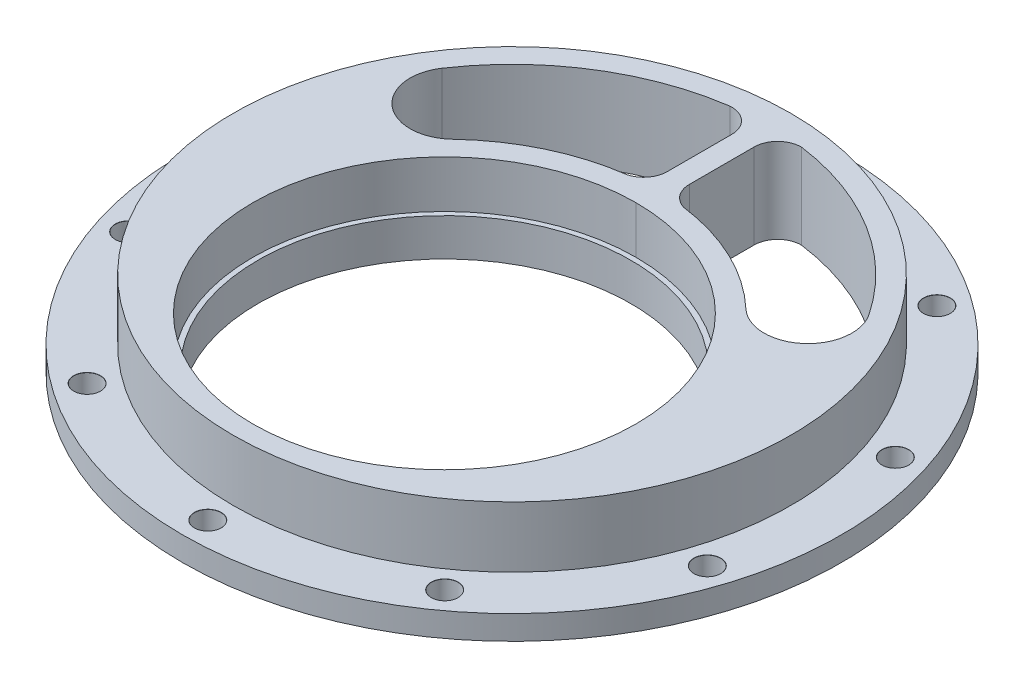
from build123d import *

# Parameters (mm, degrees)
SKETCH1_R                       = 61.9125
SKETCH1_R_2                     = 35.052
BOSS_EXTRUDE1_DEPTH             = 4.5212
SKETCH3_R                       = 52.3875
BOSS_EXTRUDE2_DEPTH             = 11.43
SKETCH4_R                       = 35.052
CUT_EXTRUDE1_DEPTH              = 89.998629731
SKETCH9_R                       = 36.000000009
CUT_EXTRUDE3_DEPTH              = 8.89
F_5_0MM_DOWEL_HOLE1_D           = 5
F_5_0MM_DOWEL_HOLE1_CSINK_D     = 5.05
F_5_0MM_DOWEL_HOLE1_CSINK_ANGLE = 90
CIRPATTERN1_COUNT               = 10
CUT_EXTRUDE5_DEPTH              = 89.998629731
BOSS_EXTRUDE3_REACH             = 89.92
BOSS_EXTRUDE3_DIRECTION_2_REACH = 89.92


with BuildPart() as part:
    # Sketch1 → Boss-Extrude1 (new body)
    with BuildSketch(Plane(origin=(0, 0, 0), x_dir=(1, 0, 0), z_dir=(0, 1, 0))):
        with Locations(Location((0, 0, 0), (0, 0, 270))):
            Circle(SKETCH1_R)
        with Locations(Location((0, -12.7, 0), (0, 0, 270))):
            Circle(SKETCH1_R_2, mode=Mode.SUBTRACT)
    extrude(amount=BOSS_EXTRUDE1_DEPTH)

    # Sketch3 → Boss-Extrude2 (add)
    with BuildSketch(Plane(origin=(0, 4.5212, 0), x_dir=(1, 0, 0), z_dir=(0, 1, 0))):
        with Locations(Location((0, 0, 0), (0, 0, 270))):
            Circle(SKETCH3_R)
    extrude(amount=BOSS_EXTRUDE2_DEPTH)

    # Sketch4 → Cut-Extrude1 (cut, through all)
    with BuildSketch(Plane.XZ):
        with Locations(Location((0, 12.7, 0), (0, 0, 270))):
            Circle(SKETCH4_R)
    extrude(amount=-CUT_EXTRUDE1_DEPTH, mode=Mode.SUBTRACT)

    # Sketch9 → Cut-Extrude3 (cut)
    with BuildSketch(Plane(origin=(0, 15.9512, 0), x_dir=(1, 0, 0), z_dir=(0, 1, 0))):
        with Locations(Location((0, -12.7, 0), (0, 0, 270))):
            Circle(SKETCH9_R)
    extrude(amount=-CUT_EXTRUDE3_DEPTH, mode=Mode.SUBTRACT)

    # Ø5.0mm Dowel Hole1 (through all)
    with Locations(Plane(origin=(0, 4.5212, 0), x_dir=(1, 0, 0), z_dir=(0, 1, 0))):
        with Locations((0, 57.15)):
            f_5_0mm_dowel_hole1 = CounterSinkHole(F_5_0MM_DOWEL_HOLE1_D / 2, F_5_0MM_DOWEL_HOLE1_CSINK_D / 2, counter_sink_angle=F_5_0MM_DOWEL_HOLE1_CSINK_ANGLE)

    # CirPattern1: Ø5.0mm Dowel Hole1 ×10 about axis
    cirpattern1_axis = Axis((0, 0, 0), (0, 1, 0))
    for i in range(1, CIRPATTERN1_COUNT):
        add(f_5_0mm_dowel_hole1.rotate(cirpattern1_axis, i * 360 / CIRPATTERN1_COUNT), mode=Mode.SUBTRACT)

    # Sketch10 → Cut-Extrude5 (cut, through all)
    with BuildSketch(Plane(origin=(0, 15.9512, 0), x_dir=(1, 0, 0), z_dir=(0, 1, 0))):
        with BuildLine():
            ThreePointArc((-27.568698422, 16.370448294), (0, 27.364000009), (27.568698422, 16.370448294))
            ThreePointArc((27.568698422, 16.370448294), (38.57955057, 16.056999754), (40.099152196, 26.966991775))
            ThreePointArc((40.099152196, 26.966991775), (0, 48.3235), (-40.099152196, 26.966991775))
            ThreePointArc((-40.099152196, 26.966991775), (-38.57955057, 16.056999754), (-27.568698422, 16.370448294))
        make_face()
    extrude(amount=-CUT_EXTRUDE5_DEPTH, mode=Mode.SUBTRACT)

    # Boss-Extrude3: up to this face of the body (flat: up to its plane)
    boss_extrude3_end = Plane(part.part.faces().sort_by_distance((0, 15.9512, -50.90575774))[0])
    # Sketch15 → Boss-Extrude3 (add, up to the picked face)
    with BuildSketch(Plane(origin=(0, 7.9756, 0), x_dir=(1, 0, 0), z_dir=(0, 1, 0)), mode=Mode.PRIVATE) as boss_extrude3_sk1:
        with BuildLine():
            ThreePointArc((2.032, 31.29096677), (2.926793499, 28.616259533), (5.250924096, 27.018407481))
            ThreePointArc((5.250924096, 27.018407481), (-0.056014781, 27.363960851), (-5.361966653, 27.003569239))
            ThreePointArc((-5.361966653, 27.003569239), (-3.020045747, 28.598028587), (-2.11713302, 31.283478782))
            Line((-2.11713302, 31.283478782), (-2.11713302, 43.39578959))
            ThreePointArc((-2.11713302, 43.39578959), (-3.543125847, 46.658245825), (-6.906163701, 47.827456081))
            ThreePointArc((-6.906163701, 47.827456081), (-0.203176512, 48.32307287), (6.503741299, 47.883838624))
            ThreePointArc((6.503741299, 47.883838624), (3.343379097, 46.591449005), (2.032, 43.438919063))
            Line((2.032, 43.438919063), (2.032, 31.29096677))
        make_face()
    boss_extrude3_tool1 = split(extrude(boss_extrude3_sk1.sketch, amount=BOSS_EXTRUDE3_REACH, mode=Mode.PRIVATE), bisect_by=boss_extrude3_end, keep=Keep.BOTH, mode=Mode.PRIVATE)
    add(boss_extrude3_tool1.solids().sort_by(Axis((-0.049426, 7.9756, -38.213586), (0, 1, 0)))[0])

    # Boss-Extrude3 direction 2: up to this face of the body (flat: up to its plane)
    boss_extrude3_direction_2_end = Plane(part.part.faces().sort_by_distance((0, 0, -60.161350056))[0])
    # Sketch15 → Boss-Extrude3 direction 2 (add, up to the picked face)
    with BuildSketch(Plane(origin=(0, 7.9756, 0), x_dir=(1, 0, 0), z_dir=(0, 1, 0)), mode=Mode.PRIVATE) as boss_extrude3_direction_2_sk1:
        with BuildLine():
            ThreePointArc((2.032, 31.29096677), (2.926793499, 28.616259533), (5.250924096, 27.018407481))
            ThreePointArc((5.250924096, 27.018407481), (-0.056014781, 27.363960851), (-5.361966653, 27.003569239))
            ThreePointArc((-5.361966653, 27.003569239), (-3.020045747, 28.598028587), (-2.11713302, 31.283478782))
            Line((-2.11713302, 31.283478782), (-2.11713302, 43.39578959))
            ThreePointArc((-2.11713302, 43.39578959), (-3.543125847, 46.658245825), (-6.906163701, 47.827456081))
            ThreePointArc((-6.906163701, 47.827456081), (-0.203176512, 48.32307287), (6.503741299, 47.883838624))
            ThreePointArc((6.503741299, 47.883838624), (3.343379097, 46.591449005), (2.032, 43.438919063))
            Line((2.032, 43.438919063), (2.032, 31.29096677))
        make_face()
    boss_extrude3_direction_2_tool1 = split(extrude(boss_extrude3_direction_2_sk1.sketch, amount=-BOSS_EXTRUDE3_DIRECTION_2_REACH, mode=Mode.PRIVATE), bisect_by=boss_extrude3_direction_2_end, keep=Keep.BOTH, mode=Mode.PRIVATE)
    add(boss_extrude3_direction_2_tool1.solids().sort_by(Axis((-0.049426, 7.9756, -38.213586), (0, -1, 0)))[0])


solid = part.part
